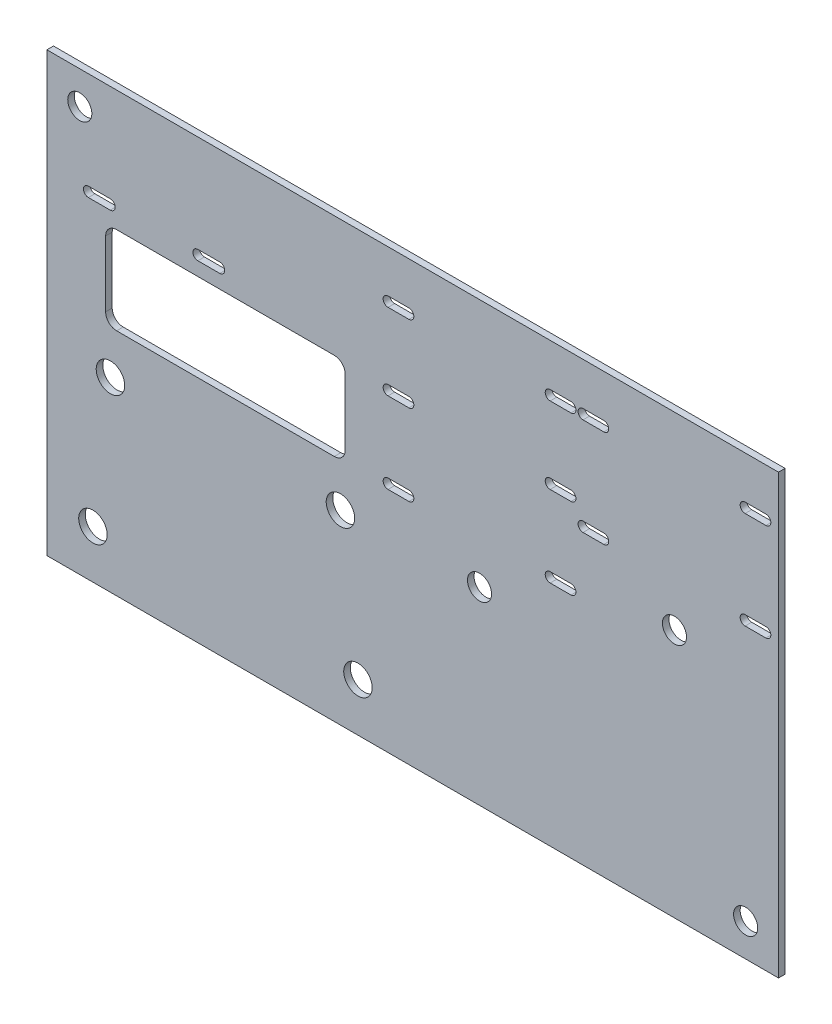
from build123d import *

# Parameters (mm, degrees)
SCHIZZO1_W                   = 200
SCHIZZO1_H                   = 200
SCHIZZO1_R                   = 6.5
ESTRUSIONE_ESTRUSIONE1_DEPTH = 3
SCHIZZO5_W                   = 3
SCHIZZO5_H                   = 200
ESTRUSIONE_ESTRUSIONE2_DEPTH = 152.5
SCHIZZO7_W                   = 3
SCHIZZO7_H                   = 200
TAGLIO_ESTRUSIONE3_DEPTH     = 18.5
SCHIZZO10_W                  = 49.389877506
SCHIZZO10_H                  = 20
TAGLIO_ESTRUSIONE4_DEPTH     = 211.4524887
SCHIZZO12_R                  = 2.25
TAGLIO_ESTRUSIONE5_DEPTH     = 211.4524887
SCHIZZO13_R                  = 2.25
TAGLIO_ESTRUSIONE6_DEPTH     = 211.4524887
SCHIZZO14_R                  = 5.5
TAGLIO_ESTRUSIONE7_DEPTH     = 211.4524887


with BuildPart() as part:
    # Schizzo1 → Estrusione-Estrusione1 (new body)
    with BuildSketch(Plane.XY):
        with Locations((-69, -3)):
            Rectangle(SCHIZZO1_W, SCHIZZO1_H)
        with Locations((-121.5, -18)):
            Circle(SCHIZZO1_R, mode=Mode.SUBTRACT)
        with Locations((-16.5, -18)):
            Circle(SCHIZZO1_R, mode=Mode.SUBTRACT)
        with Locations((-129.5, -81)):
            Circle(SCHIZZO1_R, mode=Mode.SUBTRACT)
        with Locations((-8.5, -81)):
            Circle(SCHIZZO1_R, mode=Mode.SUBTRACT)
    extrude(amount=ESTRUSIONE_ESTRUSIONE1_DEPTH)

    # Schizzo5 → Estrusione-Estrusione2 (add)
    with BuildSketch(Plane(origin=(31, 0, 0), x_dir=(0, 0, -1), z_dir=(1, 0, 0))):
        with Locations((-1.5, -3)):
            Rectangle(SCHIZZO5_W, SCHIZZO5_H)
    extrude(amount=ESTRUSIONE_ESTRUSIONE2_DEPTH)

    # Schizzo7 → Taglio-Estrusione3 (cut)
    with BuildSketch(Plane.ZY.offset(169)):
        with Locations((1.5, -3)):
            Rectangle(SCHIZZO7_W, SCHIZZO7_H)
    extrude(amount=-TAGLIO_ESTRUSIONE3_DEPTH, mode=Mode.SUBTRACT)

    # Schizzo10 → Taglio-Estrusione4 (cut, through all)
    # profile 1 of 4: a face of its own
    with BuildSketch(Plane(origin=(0, 0, 0), x_dir=(-1, 0, 0), z_dir=(0, 0, -1))):
        Polygon((44.305061247, 41.8), (34.305061247, 41.8), (34.305061247, 31.8), (34.305061247, 1.8), (103.694938753, 1.8), (103.694938753, 31.8), (103.694938753, 41.8), (93.694938753, 41.8), align=None)
        with Locations((69, 21.8)):
            Rectangle(SCHIZZO10_W, SCHIZZO10_H, mode=Mode.SUBTRACT)
    # profile 2 of 4: a face of its own
    with BuildSketch(Plane(origin=(0, 0, 0), x_dir=(-1, 0, 0), z_dir=(0, 0, -1))):
        with Locations((69, 21.8)):
            Rectangle(SCHIZZO10_W, SCHIZZO10_H)
    # profile 3 of 4: a face of its own
    with BuildSketch(Plane(origin=(0, 0, 0), x_dir=(-1, 0, 0), z_dir=(0, 0, -1))):
        with BuildLine():
            Line((103.694938753, 1.8), (103.694938753, 41.8))
            Line((103.694938753, 41.8), (118.694938753, 41.8))
            ThreePointArc((118.694938753, 41.8), (122.230472659, 40.335533906), (123.694938753, 36.8))
            Line((123.694938753, 36.8), (123.694938753, 6.8))
            ThreePointArc((123.694938753, 6.8), (122.230472659, 3.264466094), (118.694938753, 1.8))
            Line((118.694938753, 1.8), (103.694938753, 1.8))
        make_face()
    # profile 4 of 4: a face of its own
    with BuildSketch(Plane(origin=(0, 0, 0), x_dir=(-1, 0, 0), z_dir=(0, 0, -1))):
        with BuildLine():
            Line((34.305061247, 41.8), (34.305061247, 1.8))
            Line((34.305061247, 1.8), (19.305061247, 1.8))
            ThreePointArc((19.305061247, 1.8), (15.769527341, 3.264466094), (14.305061247, 6.8))
            Line((14.305061247, 6.8), (14.305061247, 36.8))
            ThreePointArc((14.305061247, 36.8), (15.769527341, 40.335533906), (19.305061247, 41.8))
            Line((19.305061247, 41.8), (34.305061247, 41.8))
        make_face()
    extrude(amount=-TAGLIO_ESTRUSIONE4_DEPTH, mode=Mode.SUBTRACT)

    # Schizzo12 → Taglio-Estrusione5 (cut, through all)
    with BuildSketch(Plane(origin=(0, 0, 0), x_dir=(-1, 0, 0), z_dir=(0, 0, -1))):
        with BuildLine():
            Line((-10.000000003, 1.05), (-5.25, 1.05))
            ThreePointArc((-5.25, 1.05), (-3, 3.3), (-5.25, 5.55))
            Line((-5.25, 5.55), (-10, 5.55))
            ThreePointArc((-10, 5.55), (-8.409009742, 4.890990258), (-7.75, 3.3))
            ThreePointArc((-7.75, 3.3), (-8.409009743, 1.709009741), (-10.000000003, 1.05))
        make_face()
        with BuildLine():
            Line((-14.75, 1.05), (-10.000000003, 1.05))
            ThreePointArc((-10.000000003, 1.05), (-12.25, 3.300000001), (-10, 5.55))
            Line((-10, 5.55), (-14.75, 5.55))
            ThreePointArc((-14.75, 5.55), (-17, 3.3), (-14.75, 1.05))
        make_face()
        with Locations((-10, 3.3)):
            Circle(SCHIZZO12_R)
        with BuildLine():
            Line((-10, 38.05), (-5.25, 38.05))
            ThreePointArc((-5.25, 38.05), (-3, 40.3), (-5.25, 42.55))
            Line((-5.25, 42.55), (-10.00000002, 42.55))
            ThreePointArc((-10.00000002, 42.55), (-8.40900975, 41.890990265), (-7.75, 40.3))
            ThreePointArc((-7.75, 40.3), (-8.409009742, 38.709009742), (-10, 38.05))
        make_face()
        with Locations((-10, 40.3)):
            Circle(SCHIZZO12_R)
        with BuildLine():
            Line((-14.75, 38.05), (-10, 38.05))
            ThreePointArc((-10, 38.05), (-12.25, 40.29999999), (-10.00000002, 42.55))
            Line((-10.00000002, 42.55), (-14.75, 42.55))
            ThreePointArc((-14.75, 42.55), (-17, 40.3), (-14.75, 38.05))
        make_face()
        with BuildLine():
            Line((-10, 73.05), (-5.25, 73.05))
            ThreePointArc((-5.25, 73.05), (-3, 75.3), (-5.25, 77.55))
            Line((-5.25, 77.55), (-10.000000033, 77.55))
            ThreePointArc((-10.000000033, 77.55), (-8.409009754, 76.890990269), (-7.75, 75.3))
            ThreePointArc((-7.75, 75.3), (-8.409009742, 73.709009742), (-10, 73.05))
        make_face()
        with Locations((-10, 75.3)):
            Circle(SCHIZZO12_R)
        with BuildLine():
            Line((-14.75, 73.05), (-10, 73.05))
            ThreePointArc((-10, 73.05), (-12.25, 75.299999983), (-10.000000033, 77.55))
            Line((-10.000000033, 77.55), (-14.75, 77.55))
            ThreePointArc((-14.75, 77.55), (-17, 75.3), (-14.75, 73.05))
        make_face()
        with BuildLine():
            Line((-88.75, 73.05), (-84, 73.05))
            ThreePointArc((-84, 73.05), (-86.25, 75.299999913), (-84.000000174, 77.55))
            Line((-84.000000174, 77.55), (-88.75, 77.55))
            ThreePointArc((-88.75, 77.55), (-91, 75.3), (-88.75, 73.05))
        make_face()
        with Locations((-84, 75.3)):
            Circle(SCHIZZO12_R)
        with BuildLine():
            Line((-84, 73.05), (-79.25, 73.05))
            ThreePointArc((-79.25, 73.05), (-77, 75.3), (-79.25, 77.55))
            Line((-79.25, 77.55), (-84.000000174, 77.55))
            ThreePointArc((-84.000000174, 77.55), (-82.409009804, 76.890990319), (-81.75, 75.3))
            ThreePointArc((-81.75, 75.3), (-82.409009742, 73.709009742), (-84, 73.05))
        make_face()
        with BuildLine():
            Line((-99, 73.05), (-94.25, 73.05))
            ThreePointArc((-94.25, 73.05), (-92, 75.3), (-94.25, 77.55))
            Line((-94.25, 77.55), (-99.00000002, 77.55))
            ThreePointArc((-99.00000002, 77.55), (-97.40900975, 76.890990265), (-96.75, 75.3))
            ThreePointArc((-96.75, 75.3), (-97.409009742, 73.709009742), (-99, 73.05))
        make_face()
        with Locations((-99, 75.3)):
            Circle(SCHIZZO12_R)
        with BuildLine():
            Line((-103.75, 73.05), (-99, 73.05))
            ThreePointArc((-99, 73.05), (-101.25, 75.29999999), (-99.00000002, 77.55))
            Line((-99.00000002, 77.55), (-103.75, 77.55))
            ThreePointArc((-103.75, 77.55), (-106, 75.3), (-103.75, 73.05))
        make_face()
        with BuildLine():
            Line((-84, 38.05), (-79.25, 38.05))
            ThreePointArc((-79.25, 38.05), (-77, 40.3), (-79.25, 42.55))
            Line((-79.25, 42.55), (-84, 42.55))
            ThreePointArc((-84, 42.55), (-82.409009742, 41.890990258), (-81.75, 40.3))
            ThreePointArc((-81.75, 40.3), (-82.409009742, 38.709009742), (-84, 38.05))
        make_face()
        with Locations((-84, 40.3)):
            Circle(SCHIZZO12_R)
        with BuildLine():
            Line((-88.75, 38.05), (-84, 38.05))
            ThreePointArc((-84, 38.05), (-86.25, 40.3), (-84, 42.55))
            Line((-84, 42.55), (-88.75, 42.55))
            ThreePointArc((-88.75, 42.55), (-91, 40.3), (-88.75, 38.05))
        make_face()
        with Locations((-84, 3.3)):
            Circle(SCHIZZO12_R)
        with BuildLine():
            Line((-84, 1.05), (-79.25, 1.05))
            ThreePointArc((-79.25, 1.05), (-77, 3.3), (-79.25, 5.55))
            Line((-79.25, 5.55), (-84, 5.55))
            ThreePointArc((-84, 5.55), (-82.409009742, 4.890990258), (-81.75, 3.3))
            ThreePointArc((-81.75, 3.3), (-82.409009742, 1.709009742), (-84, 1.05))
        make_face()
        with BuildLine():
            Line((-88.75, 1.05), (-84, 1.05))
            ThreePointArc((-84, 1.05), (-86.25, 3.3), (-84, 5.55))
            Line((-84, 5.55), (-88.75, 5.55))
            ThreePointArc((-88.75, 5.55), (-91, 3.3), (-88.75, 1.05))
        make_face()
        with BuildLine():
            Line((-99, 28.55), (-94.25, 28.55))
            ThreePointArc((-94.25, 28.55), (-92, 30.8), (-94.25, 33.05))
            Line((-94.25, 33.05), (-99, 33.05))
            ThreePointArc((-99, 33.05), (-97.409009742, 32.390990258), (-96.75, 30.8))
            ThreePointArc((-96.75, 30.8), (-97.409009742, 29.209009742), (-99, 28.55))
        make_face()
        with Locations((-99, 30.8)):
            Circle(SCHIZZO12_R)
        with BuildLine():
            Line((-103.75, 28.55), (-99, 28.55))
            ThreePointArc((-99, 28.55), (-101.25, 30.8), (-99, 33.05))
            Line((-99, 33.05), (-103.75, 33.05))
            ThreePointArc((-103.75, 33.05), (-106, 30.8), (-103.75, 28.55))
        make_face()
        with BuildLine():
            Line((-173, 28.55), (-168.25, 28.55))
            ThreePointArc((-168.25, 28.55), (-166, 30.8), (-168.25, 33.05))
            Line((-168.25, 33.05), (-173, 33.05))
            ThreePointArc((-173, 33.05), (-171.409009742, 32.390990258), (-170.75, 30.8))
            ThreePointArc((-170.75, 30.8), (-171.409009742, 29.209009742), (-173, 28.55))
        make_face()
        with Locations((-173, 30.8)):
            Circle(SCHIZZO12_R)
        with BuildLine():
            Line((-177.75, 28.55), (-173, 28.55))
            ThreePointArc((-173, 28.55), (-175.25, 30.8), (-173, 33.05))
            Line((-173, 33.05), (-177.75, 33.05))
            ThreePointArc((-177.75, 33.05), (-180, 30.8), (-177.75, 28.55))
        make_face()
        with BuildLine():
            Line((-173, 73.05), (-168.25, 73.05))
            ThreePointArc((-168.25, 73.05), (-166, 75.3), (-168.25, 77.55))
            Line((-168.25, 77.55), (-172.999999967, 77.55))
            ThreePointArc((-172.999999967, 77.55), (-171.409009731, 76.890990246), (-170.75, 75.3))
            ThreePointArc((-170.75, 75.3), (-171.409009742, 73.709009742), (-173, 73.05))
        make_face()
        with Locations((-173, 75.3)):
            Circle(SCHIZZO12_R)
        with BuildLine():
            Line((-177.75, 73.05), (-173, 73.05))
            ThreePointArc((-173, 73.05), (-175.25, 75.300000017), (-172.999999967, 77.55))
            Line((-172.999999967, 77.55), (-177.75, 77.55))
            ThreePointArc((-177.75, 77.55), (-180, 75.3), (-177.75, 73.05))
        make_face()
    extrude(amount=-TAGLIO_ESTRUSIONE5_DEPTH, mode=Mode.SUBTRACT)

    # Schizzo13 → Taglio-Estrusione6 (cut, through all)
    with BuildSketch(Plane(origin=(0, 0, 0), x_dir=(-1, 0, 0), z_dir=(0, 0, -1))):
        with BuildLine():
            Line((126.585733074, 48.05), (131.585733074, 48.05))
            ThreePointArc((131.585733074, 48.05), (133.835733074, 50.3), (131.585733074, 52.55))
            Line((131.585733074, 52.55), (126.585733074, 52.55))
            ThreePointArc((126.585733074, 52.55), (128.176723332, 51.890990258), (128.835733074, 50.3))
            ThreePointArc((128.835733074, 50.3), (128.176723332, 48.709009742), (126.585733074, 48.05))
        make_face()
        with Locations((126.585733074, 50.3)):
            Circle(SCHIZZO13_R)
        with BuildLine():
            Line((121.585733074, 48.05), (126.585733074, 48.05))
            ThreePointArc((126.585733074, 48.05), (124.335733074, 50.3), (126.585733074, 52.55))
            Line((126.585733074, 52.55), (121.585733074, 52.55))
            ThreePointArc((121.585733074, 52.55), (119.335733074, 50.3), (121.585733074, 48.05))
        make_face()
        with BuildLine():
            Line((76.585733074, 48.05), (81.585733074, 48.05))
            ThreePointArc((81.585733074, 48.05), (83.835733074, 50.3), (81.585733074, 52.55))
            Line((81.585733074, 52.55), (76.585733074, 52.55))
            ThreePointArc((76.585733074, 52.55), (78.176723332, 51.890990258), (78.835733074, 50.3))
            ThreePointArc((78.835733074, 50.3), (78.176723332, 48.709009742), (76.585733074, 48.05))
        make_face()
        with Locations((76.585733074, 50.3)):
            Circle(SCHIZZO13_R)
        with BuildLine():
            Line((71.585733074, 48.05), (76.585733074, 48.05))
            ThreePointArc((76.585733074, 48.05), (74.335733074, 50.3), (76.585733074, 52.55))
            Line((76.585733074, 52.55), (71.585733074, 52.55))
            ThreePointArc((71.585733074, 52.55), (69.335733074, 50.3), (71.585733074, 48.05))
        make_face()
    extrude(amount=-TAGLIO_ESTRUSIONE6_DEPTH, mode=Mode.SUBTRACT)

    # Schizzo14 → Taglio-Estrusione7 (cut, through all)
    with BuildSketch(Plane(origin=(0, 0, 0), x_dir=(-1, 0, 0), z_dir=(0, 0, -1))):
        with Locations((-168.5, -88)):
            Circle(SCHIZZO14_R)
        with Locations((135.5, 82)):
            Circle(SCHIZZO14_R)
        with Locations((-47, -16.7)):
            Circle(SCHIZZO14_R)
        with Locations((-136, 10.8)):
            Circle(SCHIZZO14_R)
    extrude(amount=-TAGLIO_ESTRUSIONE7_DEPTH, mode=Mode.SUBTRACT)


solid = part.part
